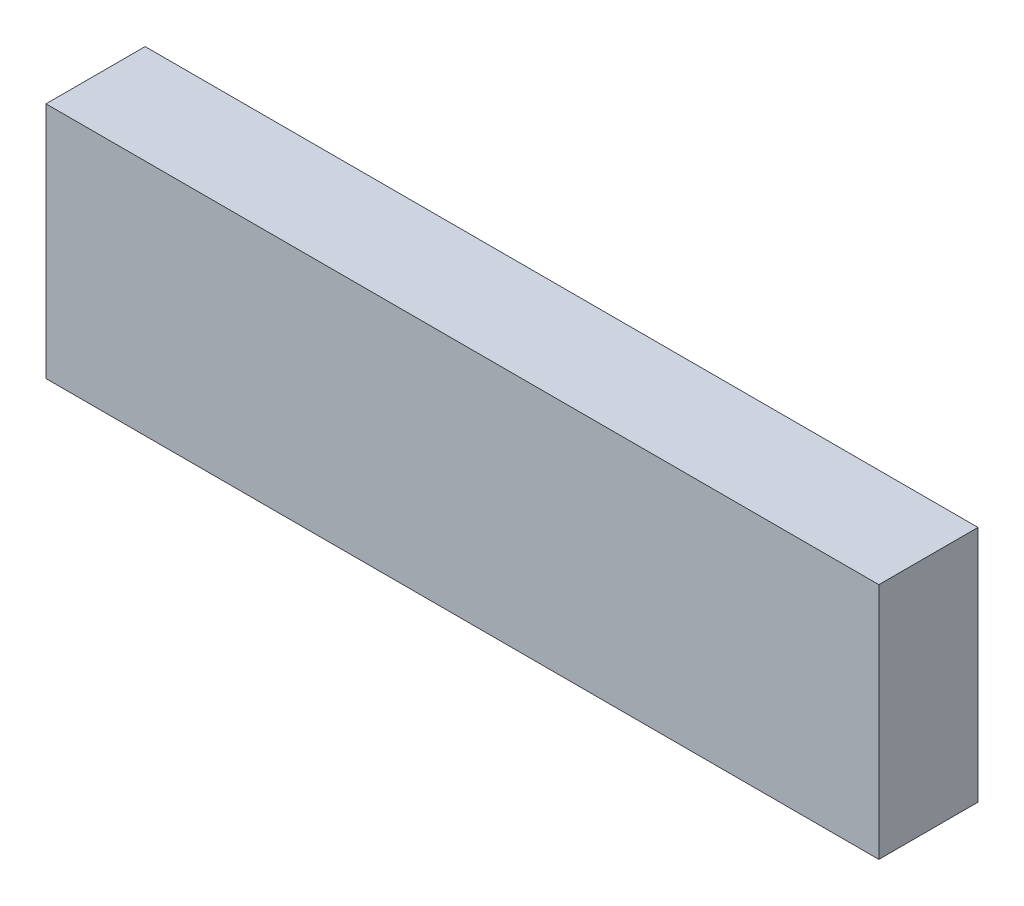
from build123d import *

# Parameters (mm, degrees)
SKETCH1_W           = 21
SKETCH1_H           = 2.5
BOSS_EXTRUDE1_DEPTH = 3


with BuildPart() as part:
    # Sketch1 → Boss-Extrude1 (new, symmetric)
    with BuildSketch(Plane(origin=(0, 0, 0), x_dir=(1, 0, 0), z_dir=(0, 1, 0))):
        Rectangle(SKETCH1_W, SKETCH1_H)
    extrude(amount=BOSS_EXTRUDE1_DEPTH, both=True)


solid = part.part
